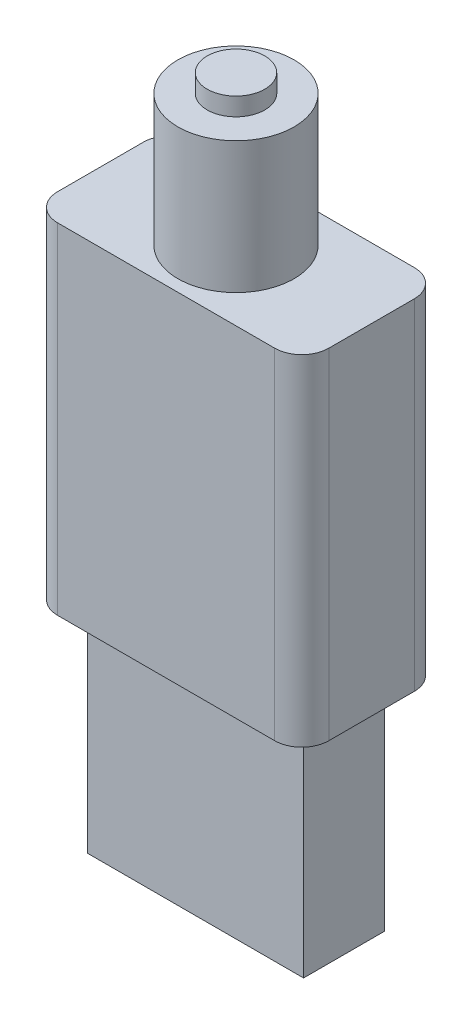
from build123d import *

# Parameters (mm, degrees)
SKETCH1_W           = 12
SKETCH1_H           = 4.5
BOSS_EXTRUDE1_DEPTH = 12.23
BOSS_EXTRUDE2_DEPTH = 18.87
SKETCH3_R           = 3.225
BOSS_EXTRUDE3_DEPTH = 7.3
SKETCH4_R           = 1.6
BOSS_EXTRUDE4_DEPTH = 1


with BuildPart() as part:
    # Sketch1 → Boss-Extrude1 (new body)
    with BuildSketch(Plane(origin=(0, 0, 0), x_dir=(1, 0, 0), z_dir=(0, 1, 0))):
        Rectangle(SKETCH1_W, SKETCH1_H)
    extrude(amount=BOSS_EXTRUDE1_DEPTH)

    # Sketch2 → Boss-Extrude2 (add)
    with BuildSketch(Plane(origin=(0, 12.23, 0), x_dir=(1, 0, 0), z_dir=(0, 1, 0))):
        with BuildLine():
            Line((-6.025, -3.875), (6.025, -3.875))
            ThreePointArc((6.025, -3.875), (7.085660172, -3.435660172), (7.525, -2.375))
            Line((7.525, -2.375), (7.525, 2.375))
            ThreePointArc((7.525, 2.375), (7.085660172, 3.435660172), (6.025, 3.875))
            Line((6.025, 3.875), (-6.025, 3.875))
            ThreePointArc((-6.025, 3.875), (-7.085660172, 3.435660172), (-7.525, 2.375))
            Line((-7.525, 2.375), (-7.525, -2.375))
            ThreePointArc((-7.525, -2.375), (-7.085660172, -3.435660172), (-6.025, -3.875))
        make_face()
    extrude(amount=BOSS_EXTRUDE2_DEPTH)

    # Sketch3 → Boss-Extrude3 (add)
    with BuildSketch(Plane(origin=(0, 31.1, 0), x_dir=(1, 0, 0), z_dir=(0, 1, 0))):
        with Locations(Location((0, 0, 0), (0, 0, 90))):
            Circle(SKETCH3_R)
    extrude(amount=BOSS_EXTRUDE3_DEPTH)

    # Sketch4 → Boss-Extrude4 (add)
    with BuildSketch(Plane(origin=(0, 38.4, 0), x_dir=(1, 0, 0), z_dir=(0, 1, 0))):
        with Locations(Location((0, 0, 0), (0, 0, 270))):
            Circle(SKETCH4_R)
    extrude(amount=BOSS_EXTRUDE4_DEPTH)


solid = part.part
